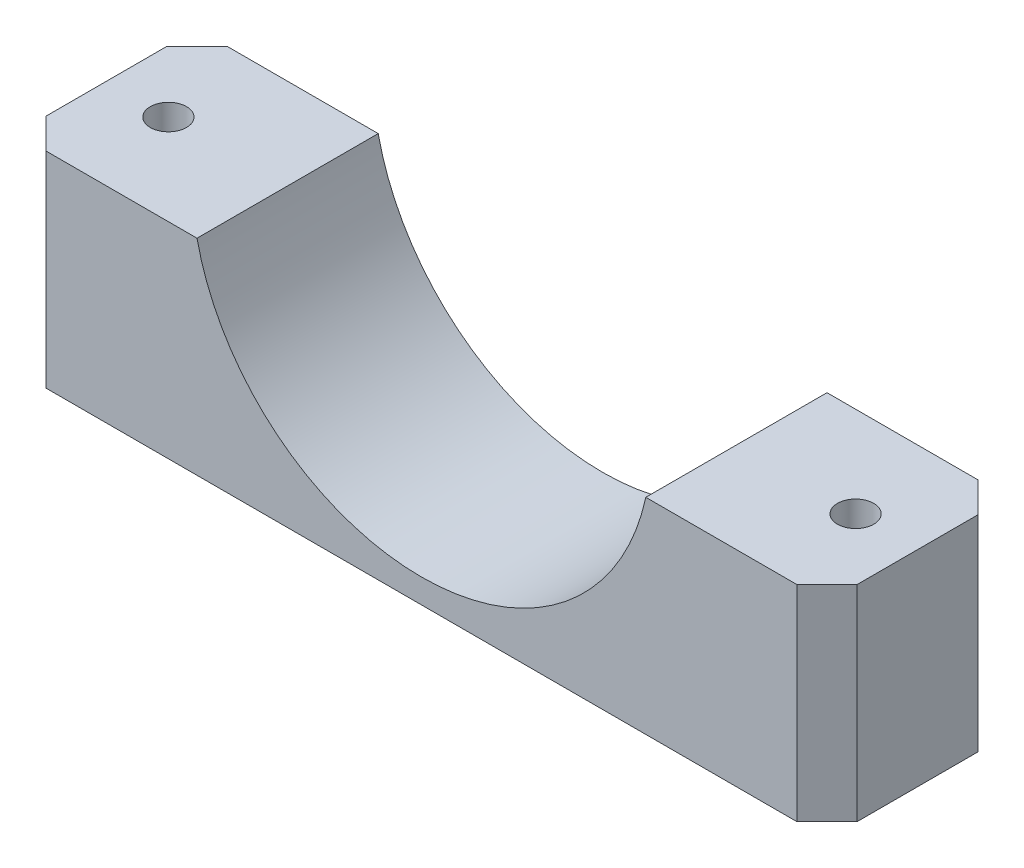
from build123d import *

# Parameters (mm, degrees)
BOSS_EXTRUDE1_DEPTH       = 15
CHAMFER1_SIZE             = 2.5
SKETCH2_R                 = 1.4
CUT_EXTRUDE1_DEPTH        = 41.512038564
F_3_0MM_DOWEL_HOLE1_D     = 3
F_3_0MM_DOWEL_HOLE1_DEPTH = 31.098709071
F_3_0MM_DOWEL_HOLE1_TIP   = 0.901290929


with BuildPart() as part:
    # Sketch1 → Boss-Extrude1 (new body)
    with BuildSketch(Plane.XY):
        with BuildLine():
            Line((-18.574175621, -4), (-33.574175621, -4))
            Line((-33.574175621, -4), (-33.574175621, -21))
            Line((-33.574175621, -21), (33.574175621, -21))
            Line((33.574175621, -21), (33.574175621, -4))
            Line((33.574175621, -4), (18.574175621, -4))
            ThreePointArc((18.574175621, -4), (0, -19), (-18.574175621, -4))
        make_face()
    extrude(amount=BOSS_EXTRUDE1_DEPTH)

    # Chamfer1
    chamfer1_edges = [part.edges().sort_by_distance(p)[0] for p in [
        (-33.574175621, -12.5, 15),
        (33.574175621, -12.5, 15),
        (-33.574175621, -12.5, 0),
        (33.574175621, -12.5, 0),
    ]]
    chamfer(chamfer1_edges, length=CHAMFER1_SIZE)

    # Sketch2 → Cut-Extrude1 (cut, through all)
    with BuildSketch(Plane(origin=(0, -4, 0), x_dir=(1, 0, 0), z_dir=(0, 1, 0))):
        with Locations(Location((28.441617262, -7.5, 0), (0, 0, 180))):
            Circle(SKETCH2_R)
        with Locations((-28.441617262, -7.5)):
            Circle(SKETCH2_R)
    extrude(amount=-CUT_EXTRUDE1_DEPTH, mode=Mode.SUBTRACT)

    # Ø3.0mm Dowel Hole1
    with Locations(Plane(origin=(0, -4, 0), x_dir=(1, 0, 0), z_dir=(0, 1, 0))):
        with Locations((-28.441617262, -7.5), (28.441617262, -7.5)):
            Hole(F_3_0MM_DOWEL_HOLE1_D / 2, depth=F_3_0MM_DOWEL_HOLE1_DEPTH)
            with Locations((0, 0, -(F_3_0MM_DOWEL_HOLE1_DEPTH + F_3_0MM_DOWEL_HOLE1_TIP / 2))):  # 118° drill point
                Cone(0, F_3_0MM_DOWEL_HOLE1_D / 2, F_3_0MM_DOWEL_HOLE1_TIP, mode=Mode.SUBTRACT)


solid = part.part
